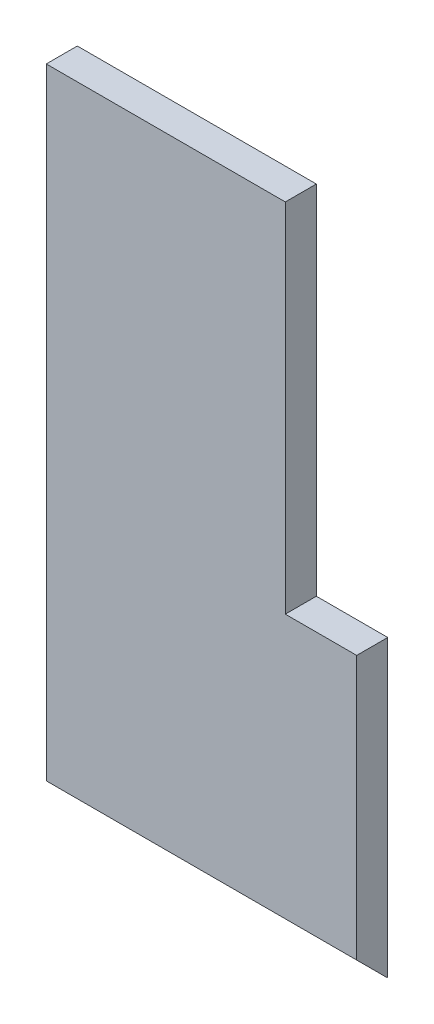
from build123d import *

# Parameters (mm, degrees)
BOSS_EXTRU_1_DEPTH      = 10
ENL_V_MAT_EXTRU_1_DEPTH = 100


with BuildPart() as part:
    # Esquisse1 → Boss.-Extru.1 (new body)
    with BuildSketch(Plane.XY):
        Polygon((-50, 105), (27, 105), (27, -10), (50, -10), (50, -105), (-50, -105), align=None)
    extrude(amount=BOSS_EXTRU_1_DEPTH)

    # Esquisse2 → Enlèv. mat.-Extru.1 (cut)
    with BuildSketch(Plane(origin=(50, 0, 0), x_dir=(0, 0, -1), z_dir=(1, 0, 0))):
        Polygon((-10, -105), (0, -105), (-10, -95), align=None)
    extrude(amount=-ENL_V_MAT_EXTRU_1_DEPTH, mode=Mode.SUBTRACT)


solid = part.part
